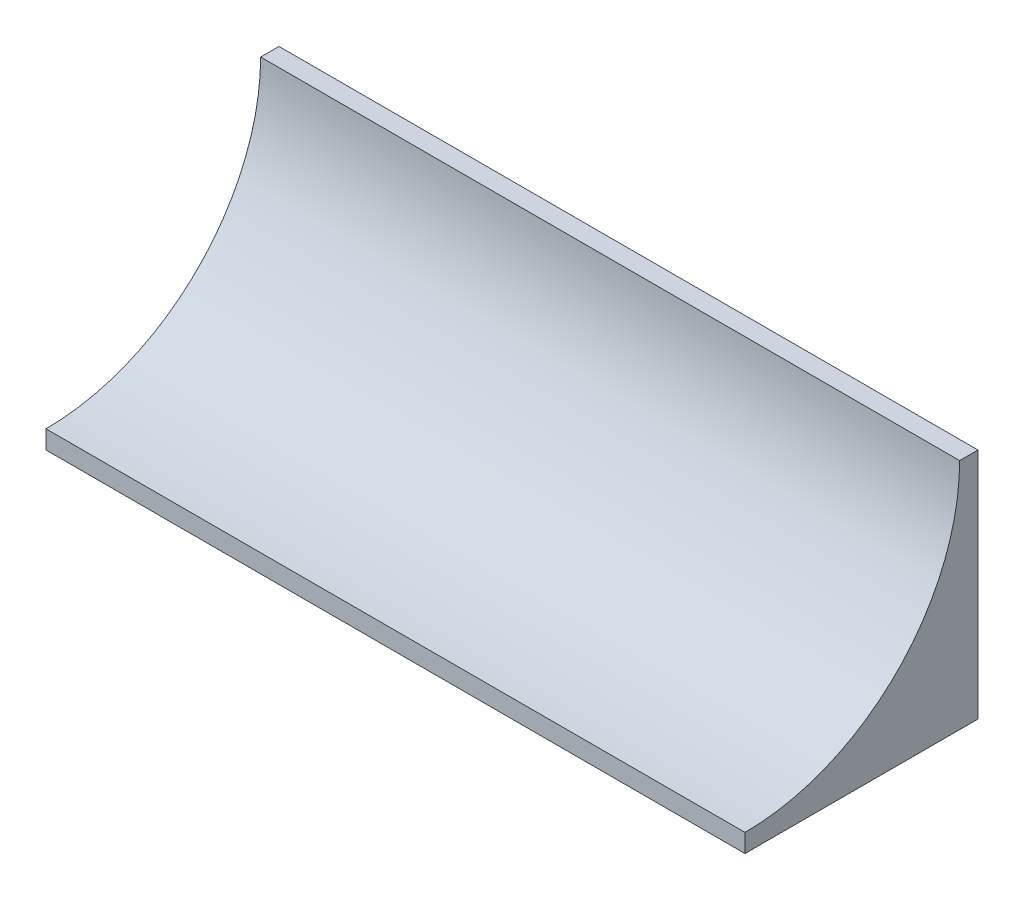
from build123d import *

# Parameters (mm, degrees)
SKETCH1_W           = 50.8
SKETCH1_H           = 50.8
BOSS_EXTRUDE1_DEPTH = 76.2
CUT_EXTRUDE1_DEPTH  = 76.2


with BuildPart() as part:
    # Sketch1 → Boss-Extrude1 (new body)
    with BuildSketch(Plane(origin=(0, 0, 0), x_dir=(0, 0, -1), z_dir=(1, 0, 0))):
        Rectangle(SKETCH1_W, SKETCH1_H)
    extrude(amount=BOSS_EXTRUDE1_DEPTH)

    # Sketch2 → Cut-Extrude1 (cut)
    with BuildSketch(Plane(origin=(76.2, 0, 0), x_dir=(0, 0, -1), z_dir=(1, 0, 0))):
        with BuildLine():
            Line((0, -25.4), (0, -23.4))
            ThreePointArc((0, -23.4), (16.54629868, -16.54629868), (23.4, 0))
            Line((23.4, 0), (25.4, 0))
            Line((25.4, 0), (25.4, 25.4))
            Line((25.4, 25.4), (-25.4, 25.4))
            Line((-25.4, 25.4), (-25.4, -25.4))
            Line((-25.4, -25.4), (0, -25.4))
        make_face()
    extrude(amount=-CUT_EXTRUDE1_DEPTH, mode=Mode.SUBTRACT)


solid = part.part
